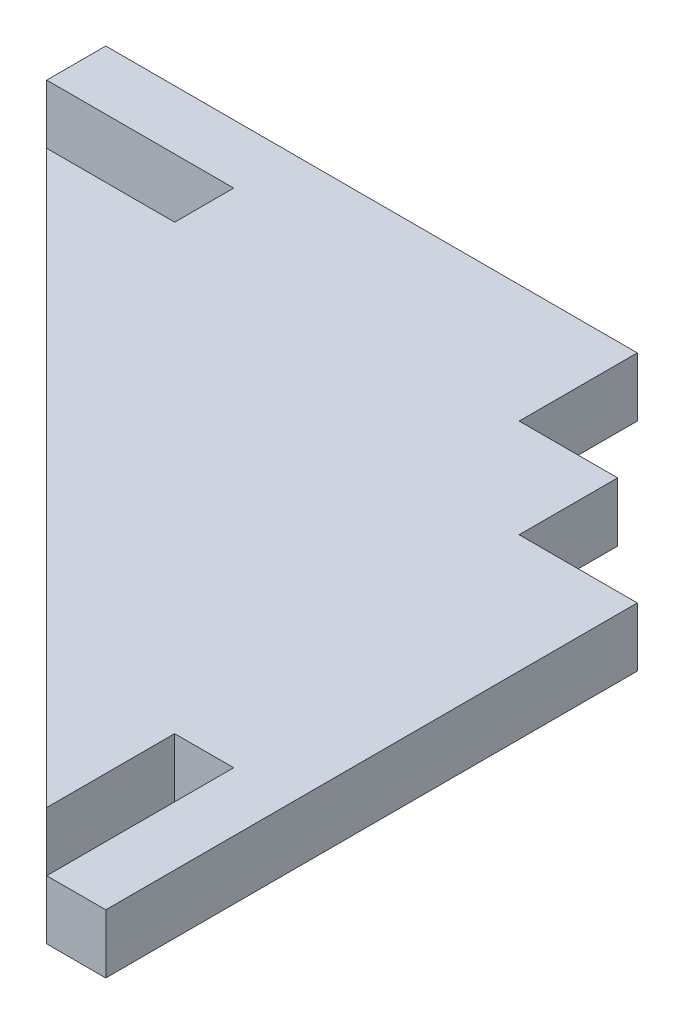
from build123d import *

# Parameters (mm, degrees)
BOSS_EXTRUDE1_DEPTH = 6
SKETCH3_W           = 19
SKETCH3_H           = 6
SKETCH3_W_2         = 6
SKETCH3_H_2         = 19
CUT_EXTRUDE1_DEPTH  = 100.176610146
SKETCH4_W           = 6
SKETCH4_H           = 6
CUT_EXTRUDE2_DEPTH  = 100.176610146


with BuildPart() as part:
    # Sketch2 → Boss-Extrude1 (new body)
    with BuildSketch(Plane(origin=(0, 0, 0), x_dir=(1, 0, 0), z_dir=(0, 1, 0))):
        Polygon((0, 0), (-10, 0), (-10, 12), (-70, 12), (12, -70), (12, -10), (0, -10), align=None)
    extrude(amount=BOSS_EXTRUDE1_DEPTH)

    # Sketch3 → Cut-Extrude1 (cut, through all)
    with BuildSketch(Plane(origin=(0, 6, 0), x_dir=(1, 0, 0), z_dir=(0, 1, 0))):
        with Locations((-54.5, 3)):
            Rectangle(SKETCH3_W, SKETCH3_H)
        with Locations((3, -54.5)):
            Rectangle(SKETCH3_W_2, SKETCH3_H_2)
    extrude(amount=-CUT_EXTRUDE1_DEPTH, mode=Mode.SUBTRACT)

    # Sketch4 → Cut-Extrude2 (cut, through all)
    with BuildSketch(Plane(origin=(0, 6, 0), x_dir=(1, 0, 0), z_dir=(0, 1, 0))):
        with Locations((-67, 9)):
            Rectangle(SKETCH4_W, SKETCH4_H)
        with Locations((9, -67)):
            Rectangle(SKETCH4_W, SKETCH4_H)
    extrude(amount=-CUT_EXTRUDE2_DEPTH, mode=Mode.SUBTRACT)


solid = part.part
